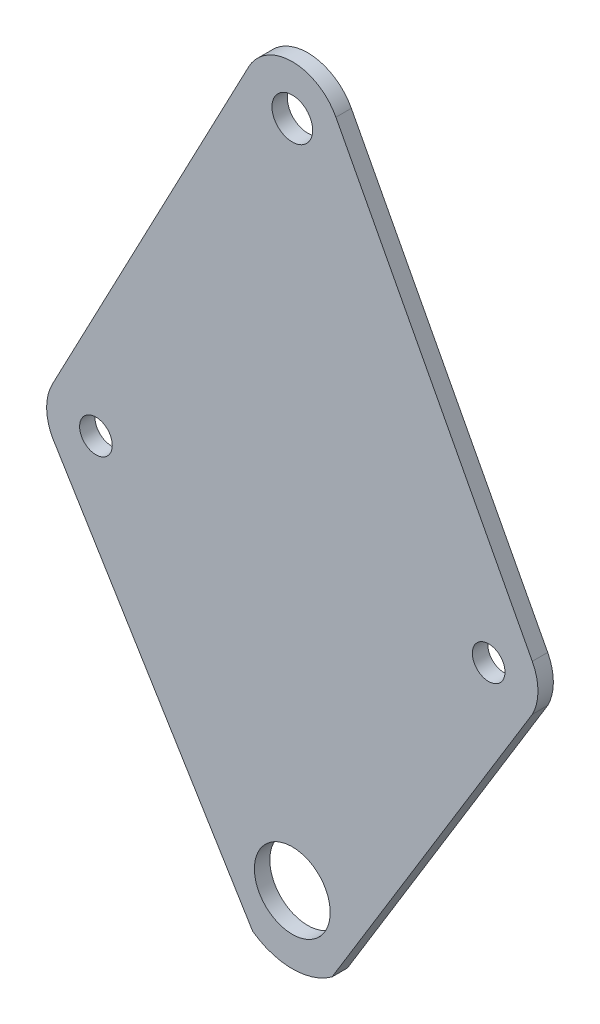
from build123d import *

# Parameters (mm, degrees)
SKETCH4_R           = 3.3655
SKETCH4_R_2         = 7.8105
SKETCH4_R_3         = 4.191
BOSS_EXTRUDE4_DEPTH = 3.175


with BuildPart() as part:
    # Sketch4 → Boss-Extrude4 (new body)
    # profile 1 of 3: a face of its own
    with BuildSketch(Plane.XY):
        with BuildLine():
            ThreePointArc((-10.16, 137.77468), (-9.863294022, 140.212103033), (-8.990505701, 142.507164257))
            Line((-8.990505701, 142.507164257), (-49.453246099, 65.638340515))
            ThreePointArc((-49.453246099, 65.638340515), (-50.622740399, 60.905856258), (-49.453246099, 56.173372001))
            Line((-49.453246099, 56.173372001), (-13.808489628, -2.118139324))
            ThreePointArc((-13.808489628, -2.118139324), (-13.929563886, -1.062144034), (-13.97, 0))
            Line((-13.97, 0), (-10.16, 137.77468))
        make_face()
        with Locations((-40.462740399, 60.905856258)):
            Circle(SKETCH4_R, mode=Mode.SUBTRACT)
    # profile 2 of 3: a face of its own
    with BuildSketch(Plane.XY):
        with BuildLine():
            ThreePointArc((49.453246099, 56.173372001), (50.622740399, 60.905856258), (49.453246099, 65.638340515))
            Line((49.453246099, 65.638340515), (8.990505701, 142.507164257))
            ThreePointArc((8.990505701, 142.507164257), (9.863294022, 140.212103033), (10.16, 137.77468))
            Line((10.16, 137.77468), (13.97, 0))
            ThreePointArc((13.97, 0), (13.929563886, -1.062144034), (13.808489628, -2.118139324))
            Line((13.808489628, -2.118139324), (49.453246099, 56.173372001))
        make_face()
        with Locations((40.462740399, 60.905856258)):
            Circle(SKETCH4_R, mode=Mode.SUBTRACT)
    # profile 3 of 3: a face of its own
    with BuildSketch(Plane.XY):
        with BuildLine():
            ThreePointArc((10.16, 137.77468), (9.863294022, 140.212103033), (8.990505701, 142.507164257))
            ThreePointArc((8.990505701, 142.507164257), (0, 147.93468), (-8.990505701, 142.507164257))
            ThreePointArc((-8.990505701, 142.507164257), (-9.863294022, 140.212103033), (-10.16, 137.77468))
            Line((-10.16, 137.77468), (-13.97, 0))
            ThreePointArc((-13.97, 0), (-13.929563886, -1.062144034), (-13.808489628, -2.118139324))
            Line((-13.808489628, -2.118139324), (-8.177790267, -11.326281223))
            ThreePointArc((-8.177790267, -11.326281223), (0, -13.97), (8.177790267, -11.326281223))
            Line((8.177790267, -11.326281223), (13.808489628, -2.118139324))
            ThreePointArc((13.808489628, -2.118139324), (13.929563886, -1.062144034), (13.97, 0))
            Line((13.97, 0), (10.16, 137.77468))
        make_face()
        Circle(SKETCH4_R_2, mode=Mode.SUBTRACT)
        with Locations((0, 137.77468)):
            Circle(SKETCH4_R_3, mode=Mode.SUBTRACT)
    extrude(amount=BOSS_EXTRUDE4_DEPTH)


solid = part.part
